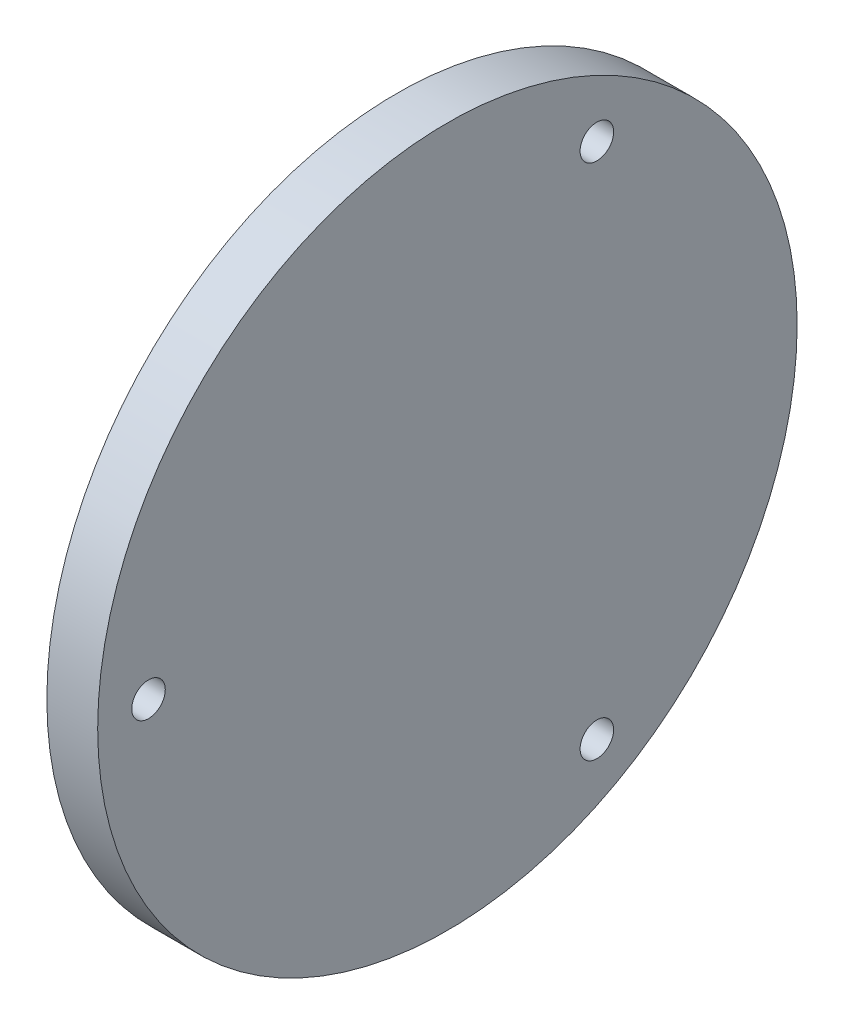
from build123d import *

# Parameters (mm, degrees)
AXIAL_PROFILE_MM_W     = 5
AXIAL_PROFILE_MM_H     = 34.4
AXIAL_HOLES_DEPTH      = 176.574514096
AXIAL_HOLES_DEPTH_BACK = 176.574514096
SKETCH2_R              = 1.65
CUT_EXTRUDE2_START     = 165.2
SKETCH3_R              = 1.65
CUT_EXTRUDE2_DEPTH     = 3.5


with BuildPart() as part:
    # Axial profile (mm) → Full revolution (revolve)
    with BuildSketch(Plane.XY, mode=Mode.PRIVATE) as full_revolution_sk:
        with Locations((166.2, 17.2)):
            Rectangle(AXIAL_PROFILE_MM_W, AXIAL_PROFILE_MM_H)
    revolve(full_revolution_sk.sketch.rotate(Axis((-110, 0, 0), (1, 0, 0)), 90), axis=Axis((-110, 0, 0), (1, 0, 0)))

    # Sketch2 → Axial holes (cut, two sides: drawn at the far end of the back side and taken through both)
    with BuildSketch(Plane(origin=(0, 0, 0), x_dir=(0, 0, -1), z_dir=(1, 0, 0)).offset(-AXIAL_HOLES_DEPTH_BACK)):
        with Locations((-29.4, 0)):
            Circle(SKETCH2_R)
        with Locations((14.7, -25.461146871)):
            Circle(SKETCH2_R)
        with Locations((14.7, 25.461146871)):
            Circle(SKETCH2_R)
    extrude(amount=AXIAL_HOLES_DEPTH + AXIAL_HOLES_DEPTH_BACK, mode=Mode.SUBTRACT)

    # Sketch3 → Cut-Extrude2 (cut)
    with BuildSketch(Plane(origin=(0, 0, 0), x_dir=(0, 0, -1), z_dir=(1, 0, 0)).offset(CUT_EXTRUDE2_START)):
        with Locations((29.4, 0)):
            Circle(SKETCH3_R)
        with Locations((-14.7, 25.461146871)):
            Circle(SKETCH3_R)
        with Locations((-14.7, -25.461146871)):
            Circle(SKETCH3_R)
    extrude(amount=-CUT_EXTRUDE2_DEPTH, mode=Mode.SUBTRACT)


solid = part.part
